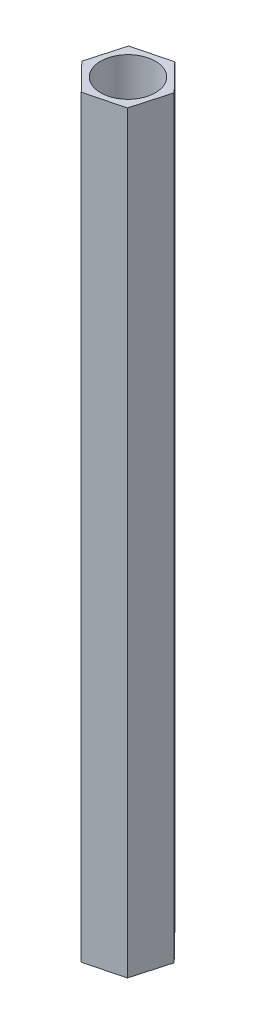
from build123d import *

# Parameters (mm, degrees)
EXTRUDE_1_DEPTH     = 34.39
SKETCH_2_R          = 1.25
CUT_EXTRUDE_1_DEPTH = 34.39


with BuildPart() as part:
    # 草图1 → 凸台-拉伸1 (new body)
    with BuildSketch(Plane(origin=(0, 0, 0), x_dir=(1, 0, 0), z_dir=(0, 1, 0))):
        Polygon((1.211610776, -1.237739604), (1.677719328, 0.430415909), (0.466108553, 1.668155513), (-1.211610776, 1.237739604), (-1.677719328, -0.430415909), (-0.466108553, -1.668155513), align=None)
    extrude(amount=EXTRUDE_1_DEPTH)

    # 草图2 → 切除-拉伸1 (cut)
    with BuildSketch(Plane(origin=(0, 34.39, 0), x_dir=(1, 0, 0), z_dir=(0, 1, 0))):
        with Locations(Location((0, 0, 0), (0, 0, 270))):
            Circle(SKETCH_2_R)
    extrude(amount=-CUT_EXTRUDE_1_DEPTH, mode=Mode.SUBTRACT)


solid = part.part
